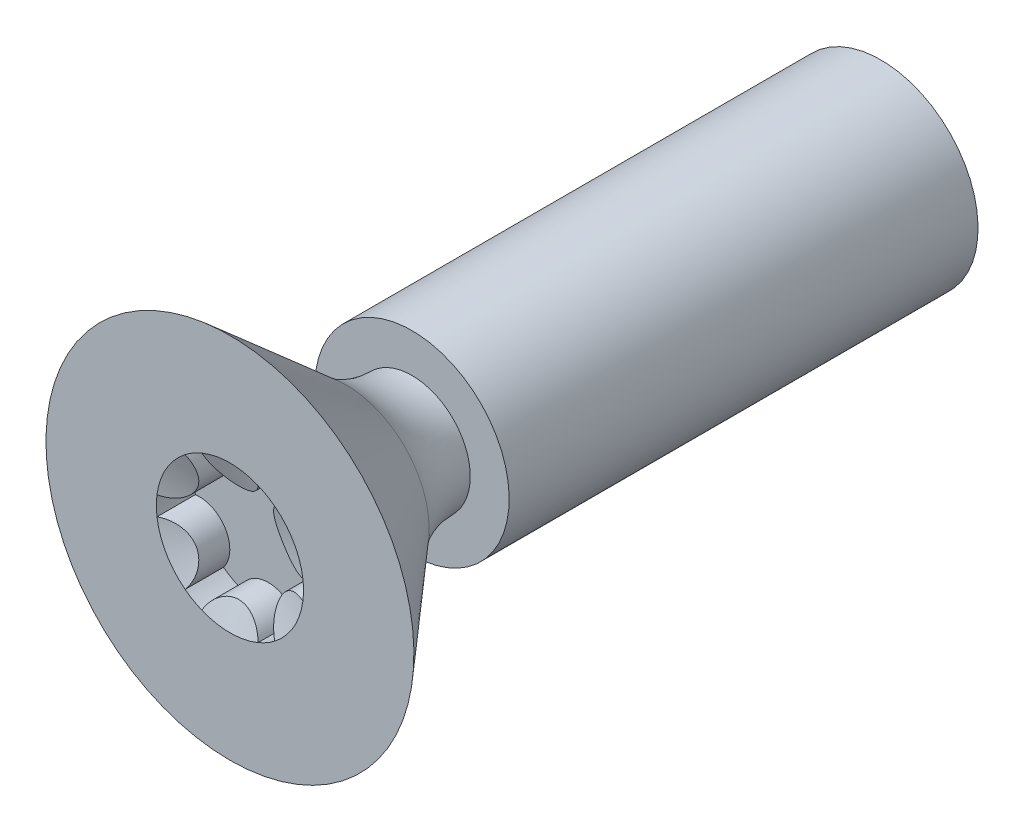
from build123d import *

# Parameters (mm, degrees)
CUT_EXTRUDE14_DEPTH = 0.561594
CIRPATTERN1_COUNT   = 6


with BuildPart() as part:
    # Sketch3 → Revolve1 (revolve)
    with BuildSketch(Plane(origin=(0, 0, 0), x_dir=(0, 0, -1), z_dir=(1, 0, 0)), mode=Mode.PRIVATE) as revolve1_sk:
        with BuildLine():
            Line((-2.09888517, 1.4224), (-2.09888517, 0.85344))
            ThreePointArc((-2.09888517, 0.85344), (-2.612306429, 0.946281688), (-3.0607, 1.21304783))
            Line((-3.0607, 1.21304783), (-4.7625, 2.6924))
            Line((-4.7625, 2.6924), (-4.7625, 0))
            Line((-4.7625, 0), (4.7625, 0))
            Line((4.7625, 0), (4.7625, 1.4224))
            Line((4.7625, 1.4224), (-2.09888517, 1.4224))
        make_face()
    revolve(revolve1_sk.sketch.rotate(Axis((0, 0, 4.7625), (0, 0, -1)), 180), axis=Axis((0, 0, 4.7625), (0, 0, -1)))

    # Sketch21 → Cut-Extrude14 (cut)
    with BuildSketch(Plane.XY.offset(4.7625)):
        with BuildLine():
            Line((0, 0), (-0.53848, 0.932674719))
            ThreePointArc((-0.53848, 0.932674719), (-0.476327228, 0.965896068), (-0.412134749, 0.994981301))
            ThreePointArc((-0.412134749, 0.994981301), (0, 0.719601666), (0.412134749, 0.994981301))
            ThreePointArc((0.412134749, 0.994981301), (0.476327228, 0.965896068), (0.53848, 0.932674719))
            Line((0.53848, 0.932674719), (0, 0))
        make_face()
    cut_extrude14 = extrude(amount=-CUT_EXTRUDE14_DEPTH, mode=Mode.SUBTRACT)

    # CirPattern1: Cut-Extrude14 ×6 about axis
    cirpattern1_axis = Axis((0, 0, 0), (0, 0, 1))
    for i in range(1, CIRPATTERN1_COUNT):
        add(cut_extrude14.rotate(cirpattern1_axis, i * 360 / CIRPATTERN1_COUNT), mode=Mode.SUBTRACT)

    # Cut-Extrude15 cone 1 section (through the dimple's axis) → Cut-Extrude15 (revolve, cut)
    with BuildSketch(Plane(origin=(0, 0, 4.7625), x_dir=(0, -1, 0), z_dir=(1, 0, 0))):
        Polygon((0, 0), (1.07696, 0), (0, 0.391981383), align=None)
    revolve(axis=Axis((0, 0, 4.7625), (0, 0, -1)), mode=Mode.SUBTRACT)


solid = part.part
